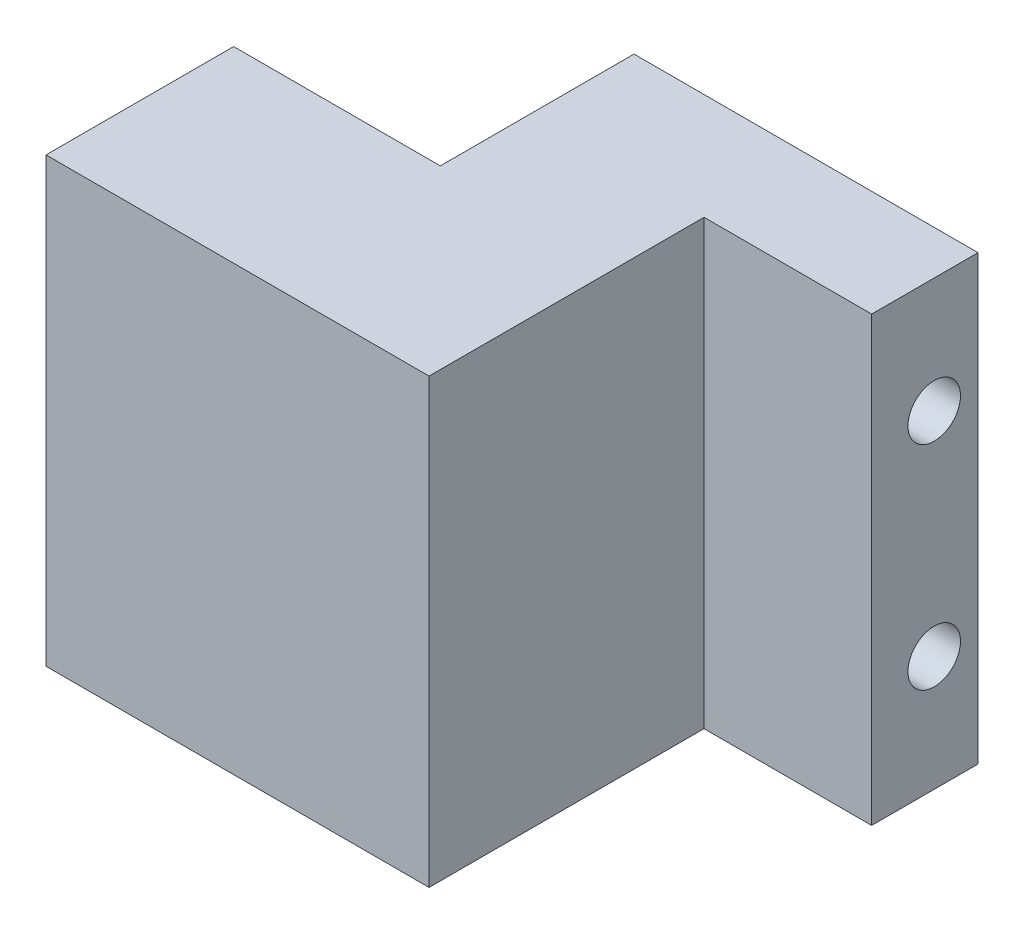
from build123d import *

# Parameters (mm, degrees)
BOSS_EXTRUDE1_DEPTH = 35.4
SKETCH2_W           = 8.63
SKETCH2_H           = 25.55
CUT_EXTRUDE1_DEPTH  = 30
SKETCH3_R           = 2.1
CUT_EXTRUDE2_DEPTH  = 64.958508207


with BuildPart() as part:
    # Sketch1 → Boss-Extrude1 (new body)
    with BuildSketch(Plane(origin=(0, 0, 0), x_dir=(1, 0, 0), z_dir=(0, 1, 0))):
        Polygon((1.0173917, 0.48), (-26.48, 0.48), (-26.48, -15), (-31.48, -15), (-43, -15), (-43, -30), (-12.38, -30), (-12.38, -8.02), (-11.48, -8.02), (1.0173917, -8.02), align=None)
    extrude(amount=BOSS_EXTRUDE1_DEPTH)

    # Sketch2 → Cut-Extrude1 (cut)
    with BuildSketch(Plane.ZY.offset(43)):
        with Locations((22.5, 17.7)):
            Rectangle(SKETCH2_W, SKETCH2_H)
    extrude(amount=-CUT_EXTRUDE1_DEPTH, mode=Mode.SUBTRACT)

    # Sketch3 → Cut-Extrude2 (cut, through all)
    with BuildSketch(Plane(origin=(1.0173917, 0, 0), x_dir=(0, 0, -1), z_dir=(1, 0, 0))):
        with Locations((-3.02, 9.2)):
            Circle(SKETCH3_R)
        with Locations((-3.02, 26.2)):
            Circle(SKETCH3_R)
    extrude(amount=-CUT_EXTRUDE2_DEPTH, mode=Mode.SUBTRACT)


solid = part.part
